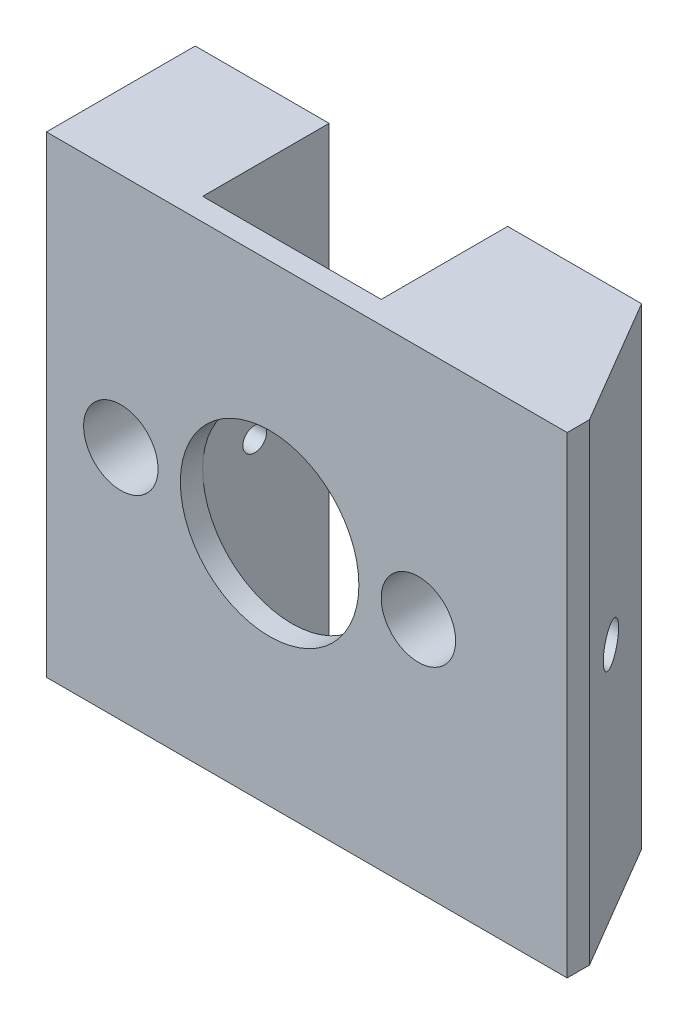
from build123d import *

# Parameters (mm, degrees)
SKETCH_1_W          = 18
SKETCH_1_H          = 63.5
SKETCH_1_R          = 5
EXTRUDE_1_DEPTH     = 17
EXTRUDE_1_2_DEPTH   = 17
SKETCH_2_W          = 60
SKETCH_2_H          = 63.5
SKETCH_2_R          = 5
SKETCH_2_R_2        = 12
EXTRUDE_2_DEPTH     = 3
SKETCH_3_W          = 3
SKETCH_3_H          = 63.5
EXTRUDE_3_DEPTH     = 10
RIB_1_REACH         = 88.355
SKETCH_4_WALL_W     = 194.433823758
SKETCH_4_WALL_H     = 63.5
SKETCH_7_W          = 3
SKETCH_7_H          = 7
CUT_EXTRUDE_1_DEPTH = 3.5
HOLE_WIZARD_1_D     = 3.2
SKETCH_13_R         = 2.5
CUT_EXTRUDE_2_DEPTH = 11


with BuildPart() as part:
    # 草图1 → 凸台-拉伸1 (new body)
    with BuildSketch(Plane.XY):
        with Locations((36, 49.25)):
            Rectangle(SKETCH_1_W, SKETCH_1_H)
        with Locations((35, 49.25)):
            Circle(SKETCH_1_R, mode=Mode.SUBTRACT)
    extrude(amount=EXTRUDE_1_DEPTH)



with BuildPart() as body_2:
    # 草图1 → Extrude 1 2 (new body)
    with BuildSketch(Plane.XY):
        with Locations((-6, 49.25)):
            Rectangle(SKETCH_1_W, SKETCH_1_H)
        with Locations((-5, 49.25)):
            Circle(SKETCH_1_R, mode=Mode.SUBTRACT)
    extrude(amount=EXTRUDE_1_2_DEPTH)


with BuildPart() as part_1:
    add(part.part)

    add(body_2.part)  # 凸台-拉伸2 merges body 2
    # 草图2 → 凸台-拉伸2 (add)
    with BuildSketch(Plane.XY.offset(17)):
        with Locations((15, 49.25)):
            Rectangle(SKETCH_2_W, SKETCH_2_H)
        with Locations((35, 49.25)):
            Circle(SKETCH_2_R, mode=Mode.SUBTRACT)
        with Locations((-5, 49.25)):
            Circle(SKETCH_2_R, mode=Mode.SUBTRACT)
        with Locations((15, 49.25)):
            Circle(SKETCH_2_R_2, mode=Mode.SUBTRACT)
    extrude(amount=EXTRUDE_2_DEPTH)

    # 草图3 → 凸台-拉伸3 (add)
    with BuildSketch(Plane(origin=(45, 0, 0), x_dir=(0, 0, -1), z_dir=(1, 0, 0))):
        with Locations((-18.5, 49.25)):
            Rectangle(SKETCH_3_W, SKETCH_3_H)
    extrude(amount=EXTRUDE_3_DEPTH)

    # 草图4 wall → 筋1 (add, up to next)
    with BuildSketch(Plane(origin=(50, 17.5, 8.5), x_dir=(-0.507020126563, 0, -0.861934215158), z_dir=(0.861934215158, 0, -0.507020126563)), mode=Mode.PRIVATE) as rib_1_sk1:
        with Locations((0, 31.75)):
            Rectangle(SKETCH_4_WALL_W, SKETCH_4_WALL_H)
    rib_1_tool1 = extrude(rib_1_sk1.sketch, amount=-RIB_1_REACH, mode=Mode.PRIVATE) - part_1.part
    add(rib_1_tool1.solids().sort_by_distance((50, 17.5, 8.5))[0])

    # 草图7 → 切除-拉伸1 (cut, symmetric)
    with BuildSketch(Plane.XY.offset(10)):
        with Locations((-12.5, 49.25)):
            Rectangle(SKETCH_7_W, SKETCH_7_H)
        with Locations((42.5, 49.25)):
            Rectangle(SKETCH_7_W, SKETCH_7_H)
    extrude(amount=CUT_EXTRUDE_1_DEPTH, both=True, mode=Mode.SUBTRACT)

    # 孔1 (through all)
    with Locations(Plane.ZY.offset(15)):
        with Locations((10, 49.25)):
            Hole(HOLE_WIZARD_1_D / 2)

    # 草图13 → 切除-拉伸2 (cut)
    with BuildSketch(Plane.ZY.offset(-47)):
        with Locations((10, 49.25)):
            Circle(SKETCH_13_R)
    extrude(amount=-CUT_EXTRUDE_2_DEPTH, mode=Mode.SUBTRACT)


solid = part_1.part
